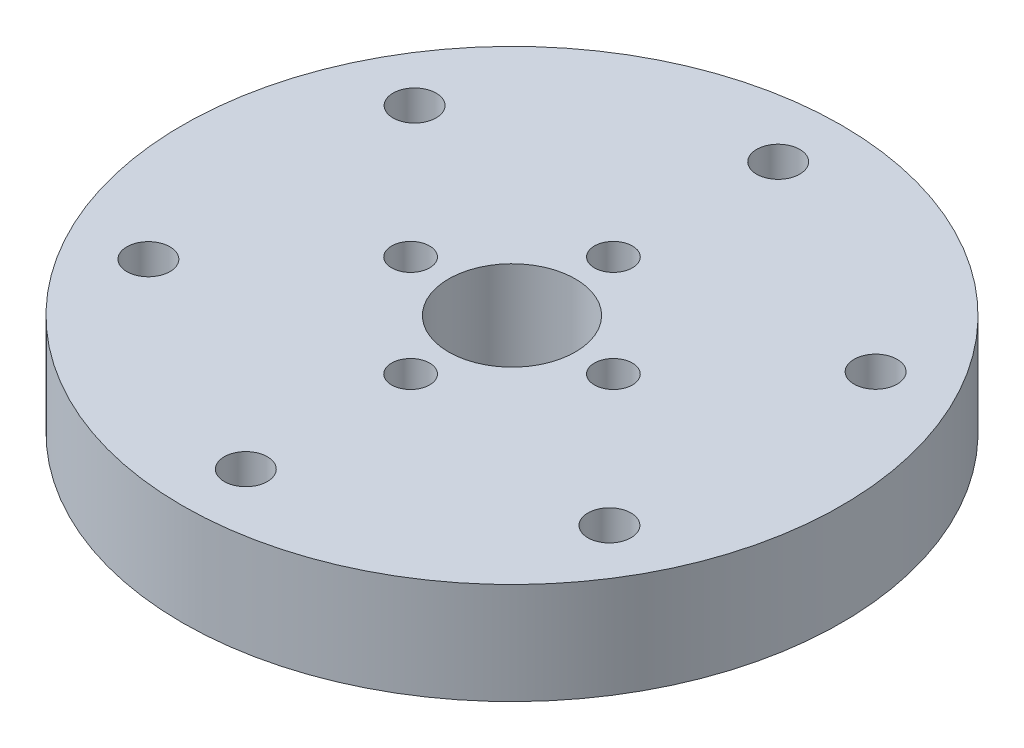
from build123d import *

# Parameters (mm, degrees)
SKETCH1_R           = 26
SKETCH1_R_2         = 1.5
SKETCH1_R_3         = 5
SKETCH1_R_4         = 1.7
BOSS_EXTRUDE1_DEPTH = 4.7
BOSS_EXTRUDE2_START = -3.3
SKETCH1_3_R         = 26
SKETCH1_3_R_2       = 3.25
SKETCH1_3_R_3       = 1.5
SKETCH1_3_R_4       = 5
BOSS_EXTRUDE2_DEPTH = 3.3


with BuildPart() as part:
    # Sketch1 → Boss-Extrude1 (new body)
    with BuildSketch(Plane(origin=(0, 0, 0), x_dir=(1, 0, 0), z_dir=(0, 1, 0))):
        Circle(SKETCH1_R)
        with Locations((0, -8)):
            Circle(SKETCH1_R_2, mode=Mode.SUBTRACT)
        with Locations((8, 0)):
            Circle(SKETCH1_R_2, mode=Mode.SUBTRACT)
        with Locations((-8, 0)):
            Circle(SKETCH1_R_2, mode=Mode.SUBTRACT)
        Circle(SKETCH1_R_3, mode=Mode.SUBTRACT)
        with Locations((0, 8)):
            Circle(SKETCH1_R_2, mode=Mode.SUBTRACT)
        with Locations((0, -21)):
            Circle(SKETCH1_R_4, mode=Mode.SUBTRACT)
        with Locations((-18.186533479, -10.5)):
            Circle(SKETCH1_R_4, mode=Mode.SUBTRACT)
        with Locations((18.186533479, -10.5)):
            Circle(SKETCH1_R_4, mode=Mode.SUBTRACT)
        with Locations((-18.186533479, 10.5)):
            Circle(SKETCH1_R_4, mode=Mode.SUBTRACT)
        with Locations((18.186533479, 10.5)):
            Circle(SKETCH1_R_4, mode=Mode.SUBTRACT)
        with Locations((0, 21)):
            Circle(SKETCH1_R_4, mode=Mode.SUBTRACT)
    extrude(amount=BOSS_EXTRUDE1_DEPTH)

    # Sketch1<3> → Boss-Extrude2 (add)
    with BuildSketch(Plane(origin=(0, 0, 0), x_dir=(1, 0, 0), z_dir=(0, 1, 0)).offset(BOSS_EXTRUDE2_START)):
        Circle(SKETCH1_3_R)
        with Locations((0, -21)):
            Circle(SKETCH1_3_R_2, mode=Mode.SUBTRACT)
        with Locations((-18.186533479, -10.5)):
            Circle(SKETCH1_3_R_2, mode=Mode.SUBTRACT)
        with Locations((0, -8)):
            Circle(SKETCH1_3_R_3, mode=Mode.SUBTRACT)
        with Locations((8, 0)):
            Circle(SKETCH1_3_R_3, mode=Mode.SUBTRACT)
        with Locations((18.186533479, -10.5)):
            Circle(SKETCH1_3_R_2, mode=Mode.SUBTRACT)
        with Locations((-18.186533479, 10.5)):
            Circle(SKETCH1_3_R_2, mode=Mode.SUBTRACT)
        with Locations((-8, 0)):
            Circle(SKETCH1_3_R_3, mode=Mode.SUBTRACT)
        Circle(SKETCH1_3_R_4, mode=Mode.SUBTRACT)
        with Locations((0, 8)):
            Circle(SKETCH1_3_R_3, mode=Mode.SUBTRACT)
        with Locations((18.186533479, 10.5)):
            Circle(SKETCH1_3_R_2, mode=Mode.SUBTRACT)
        with Locations((0, 21)):
            Circle(SKETCH1_3_R_2, mode=Mode.SUBTRACT)
    extrude(amount=BOSS_EXTRUDE2_DEPTH)


solid = part.part
